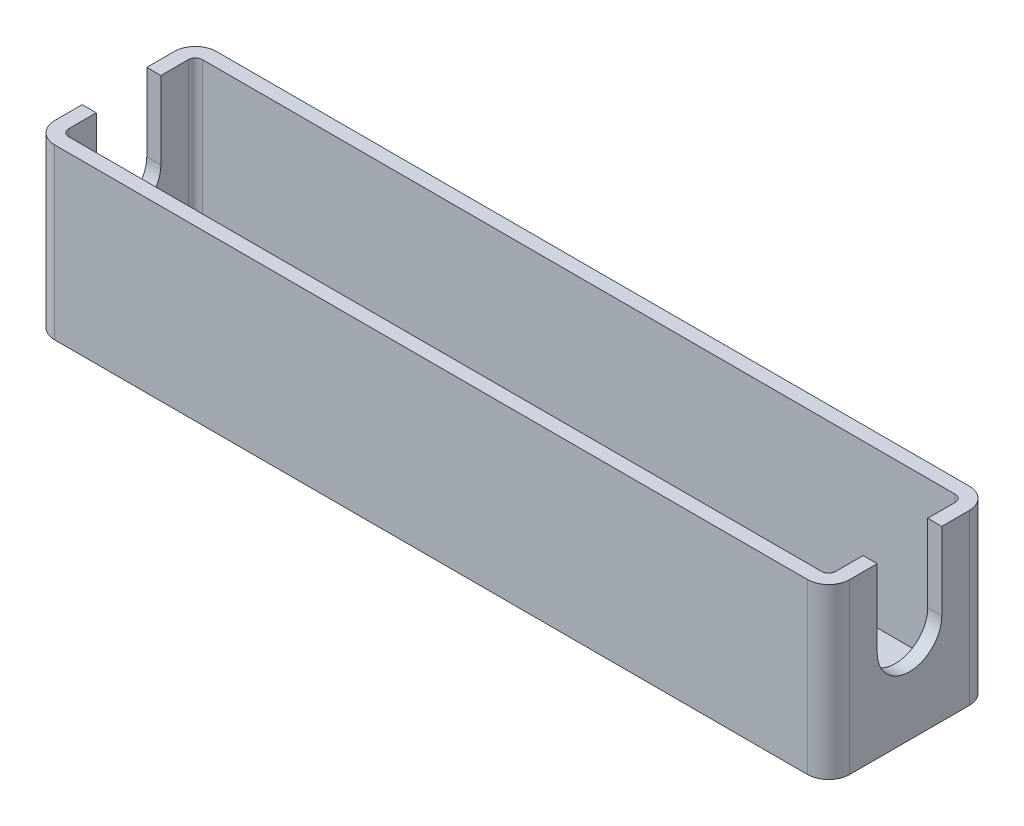
from build123d import *

# Parameters (mm, degrees)
BOSS_EXTRUDE1_DEPTH = 24
SHELL2_T            = -2
CUT_EXTRUDE1_DEPTH  = 117.091558694


with BuildPart() as part:
    # Sketch1 → Boss-Extrude1 (new body)
    with BuildSketch(Plane(origin=(0, 0, 0), x_dir=(1, 0, 0), z_dir=(0, 1, 0))):
        with BuildLine():
            Line((-53.5, -11.5), (53.5, -11.5))
            ThreePointArc((53.5, -11.5), (55.621320344, -10.621320344), (56.5, -8.5))
            Line((56.5, -8.5), (56.5, 8.5))
            ThreePointArc((56.5, 8.5), (55.621320344, 10.621320344), (53.5, 11.5))
            Line((53.5, 11.5), (-53.5, 11.5))
            ThreePointArc((-53.5, 11.5), (-55.621320344, 10.621320344), (-56.5, 8.5))
            Line((-56.5, 8.5), (-56.5, -8.5))
            ThreePointArc((-56.5, -8.5), (-55.621320344, -10.621320344), (-53.5, -11.5))
        make_face()
    extrude(amount=BOSS_EXTRUDE1_DEPTH)

    # Shell2
    shell2_openings = [part.faces().sort_by_distance(p)[0] for p in [
        (0, 24, 0),
    ]]
    offset(amount=SHELL2_T, openings=shell2_openings, kind=Kind.INTERSECTION)

    # Sketch4 → Cut-Extrude1 (cut, through all)
    with BuildSketch(Plane(origin=(56.5, 0, 0), x_dir=(0, 0, -1), z_dir=(1, 0, 0))):
        with BuildLine():
            Line((-4.588804417, 24), (-4.588804417, 13))
            ThreePointArc((-4.588804417, 13), (0, 8.411195583), (4.588804417, 13))
            Line((4.588804417, 13), (4.588804417, 24))
            Line((4.588804417, 24), (-4.588804417, 24))
        make_face()
    extrude(amount=-CUT_EXTRUDE1_DEPTH, mode=Mode.SUBTRACT)


solid = part.part
